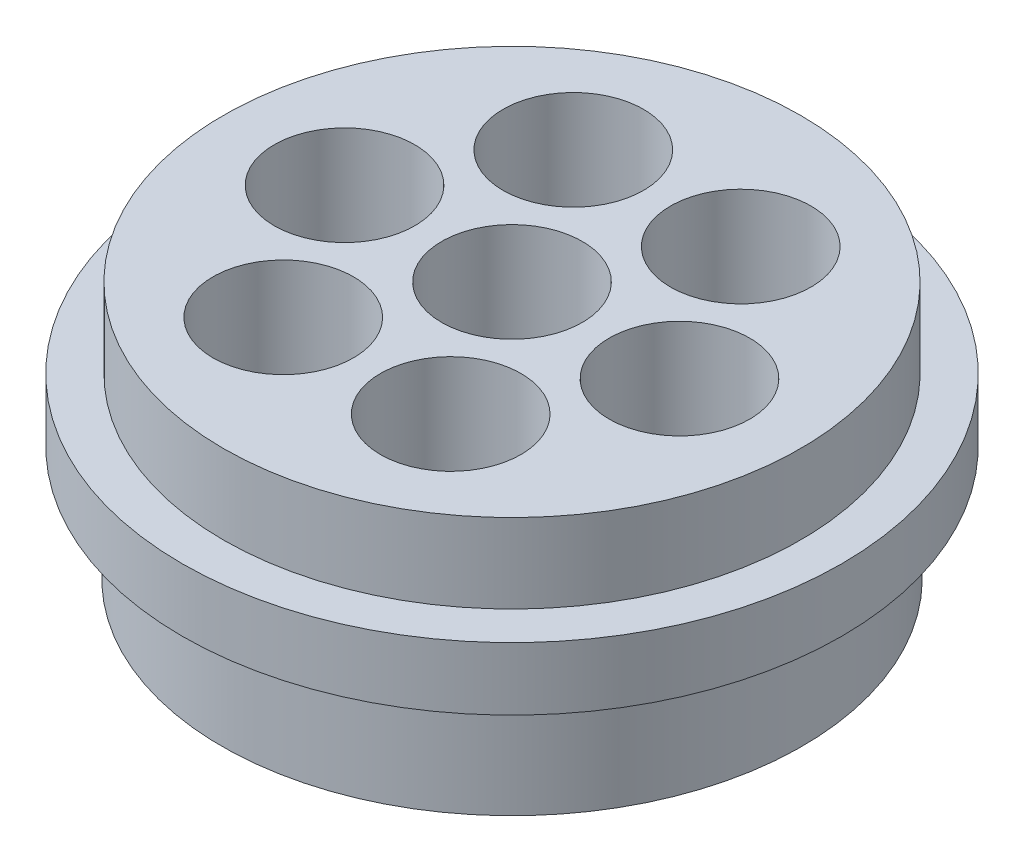
from build123d import *

# Parameters (mm, degrees)
CROQUIS4_R              = 9.7
SALIENTE_EXTRUIR2_DEPTH = 3.85
CROQUIS5_R              = 11.025
SALIENTE_EXTRUIR3_DEPTH = 2.1
CROQUIS6_R              = 9.65
SALIENTE_EXTRUIR4_DEPTH = 2.65
CROQUIS8_R              = 8.725
CORTAR_EXTRUIR2_DEPTH   = 4.05
CROQUIS9_R              = 2.35
CORTAR_EXTRUIR3_DEPTH   = 4.55
CROQUIS10_R             = 1.2
SALIENTE_EXTRUIR5_DEPTH = 4.05


with BuildPart() as part:
    # Croquis4 → Saliente-Extruir2 (new body)
    with BuildSketch(Plane(origin=(0, 0, 0), x_dir=(1, 0, 0), z_dir=(0, 1, 0))):
        with Locations(Location((0, 0, 0), (0, 0, 90))):
            Circle(CROQUIS4_R)
    extrude(amount=SALIENTE_EXTRUIR2_DEPTH)

    # Croquis5 → Saliente-Extruir3 (add)
    with BuildSketch(Plane(origin=(0, 3.85, 0), x_dir=(1, 0, 0), z_dir=(0, 1, 0))):
        with Locations(Location((0, 0, 0), (0, 0, 270))):
            Circle(CROQUIS5_R)
    extrude(amount=SALIENTE_EXTRUIR3_DEPTH)

    # Croquis6 → Saliente-Extruir4 (add)
    with BuildSketch(Plane(origin=(0, 5.95, 0), x_dir=(1, 0, 0), z_dir=(0, 1, 0))):
        with Locations(Location((0, 0, 0), (0, 0, 270))):
            Circle(CROQUIS6_R)
    extrude(amount=SALIENTE_EXTRUIR4_DEPTH)

    # Croquis8 → Cortar-Extruir2 (cut)
    with BuildSketch(Plane.XZ):
        with Locations(Location((0, 0, 0), (0, 0, 270))):
            Circle(CROQUIS8_R)
    extrude(amount=-CORTAR_EXTRUIR2_DEPTH, mode=Mode.SUBTRACT)

    # Croquis9 → Cortar-Extruir3 (cut)
    with BuildSketch(Plane(origin=(0, 8.6, 0), x_dir=(1, 0, 0), z_dir=(0, 1, 0))):
        with Locations(Location((-2.8, 4.849742261, 0), (0, 0, 270))):
            Circle(CROQUIS9_R)
        with Locations(Location((5.6, 0, 0), (0, 0, 270))):
            Circle(CROQUIS9_R)
        with Locations(Location((0, 0, 0), (0, 0, 270))):
            Circle(CROQUIS9_R)
        with Locations(Location((2.8, 4.849742261, 0), (0, 0, 270))):
            Circle(CROQUIS9_R)
        with Locations(Location((2.8, -4.849742261, 0), (0, 0, 270))):
            Circle(CROQUIS9_R)
        with Locations(Location((-2.800010296, -4.849760094, 0), (0, 0, 270))):
            Circle(CROQUIS9_R)
        with Locations(Location((-5.6, 0, 0), (0, 0, 270))):
            Circle(CROQUIS9_R)
    extrude(amount=-CORTAR_EXTRUIR3_DEPTH, mode=Mode.SUBTRACT)

    # Croquis10 → Saliente-Extruir5 (add)
    with BuildSketch(Plane.XZ.offset(-4.05)):
        with Locations((0, 8.3)):
            Circle(CROQUIS10_R)
        with Locations((-7.188010851, 4.15)):
            Circle(CROQUIS10_R)
        with Locations((-7.188010851, -4.15)):
            Circle(CROQUIS10_R)
        with Locations((0, -8.3)):
            Circle(CROQUIS10_R)
        with Locations((7.188010851, -4.15)):
            Circle(CROQUIS10_R)
        with Locations((7.188010851, 4.15)):
            Circle(CROQUIS10_R)
    extrude(amount=SALIENTE_EXTRUIR5_DEPTH)


solid = part.part
